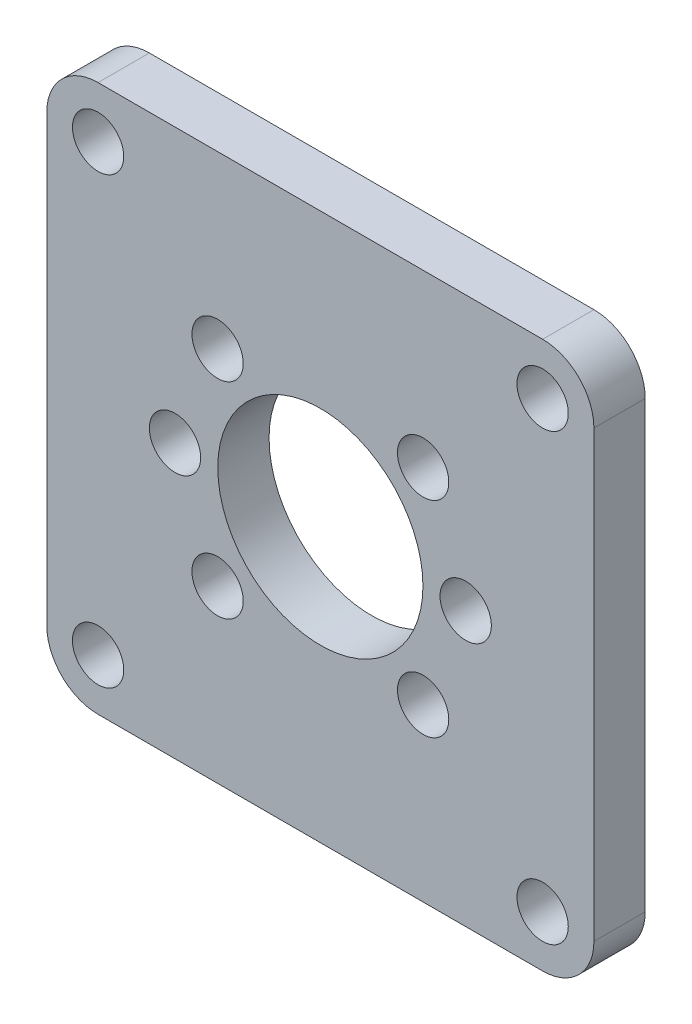
from build123d import *

# Parameters (mm, degrees)
BOSS_EXTRU_1_DEPTH      = 3
ESQUISSE2_R             = 6
ESQUISSE2_R_2           = 1.5
ENL_V_MAT_EXTRU_1_DEPTH = 23.825424421
ESQUISSE3_R             = 1.5
ENL_V_MAT_EXTRU_2_DEPTH = 23.825424421


with BuildPart() as part:
    # Esquisse1 → Boss.-Extru.1 (new body)
    with BuildSketch(Plane.XY):
        with BuildLine():
            Line((-13, -16), (13, -16))
            ThreePointArc((13, -16), (15.121320344, -15.121320344), (16, -13))
            Line((16, -13), (16, 13))
            ThreePointArc((16, 13), (15.121320344, 15.121320344), (13, 16))
            Line((13, 16), (-13, 16))
            ThreePointArc((-13, 16), (-15.121320344, 15.121320344), (-16, 13))
            Line((-16, 13), (-16, -13))
            ThreePointArc((-16, -13), (-15.121320344, -15.121320344), (-13, -16))
        make_face()
    extrude(amount=BOSS_EXTRU_1_DEPTH)

    # Esquisse2 → Enlèv. mat.-Extru.1 (cut, through all)
    with BuildSketch(Plane.XY.offset(3)):
        Circle(ESQUISSE2_R)
        with Locations((-8.5, 0)):
            Circle(ESQUISSE2_R_2)
        with Locations((-6.01040764, 6.01040764)):
            Circle(ESQUISSE2_R_2)
        with Locations(Location((-6.01040764, -6.01040764, 0), (0, 0, 180))):
            Circle(ESQUISSE2_R_2)
        with Locations((6.01040764, -6.01040764)):
            Circle(ESQUISSE2_R_2)
        with Locations(Location((8.5, 0, 0), (0, 0, 180))):
            Circle(ESQUISSE2_R_2)
        with Locations(Location((6.01040764, 6.01040764, 0), (0, 0, 180))):
            Circle(ESQUISSE2_R_2)
    extrude(amount=-ENL_V_MAT_EXTRU_1_DEPTH, mode=Mode.SUBTRACT)

    # Esquisse3 → Enlèv. mat.-Extru.2 (cut, through all)
    with BuildSketch(Plane.XY.offset(3)):
        with Locations((-13, 13)):
            Circle(ESQUISSE3_R)
        with Locations(Location((13, 13, 0), (0, 0, 180))):
            Circle(ESQUISSE3_R)
        with Locations((13, -13)):
            Circle(ESQUISSE3_R)
        with Locations(Location((-13, -13, 0), (0, 0, 180))):
            Circle(ESQUISSE3_R)
    extrude(amount=-ENL_V_MAT_EXTRU_2_DEPTH, mode=Mode.SUBTRACT)


solid = part.part
